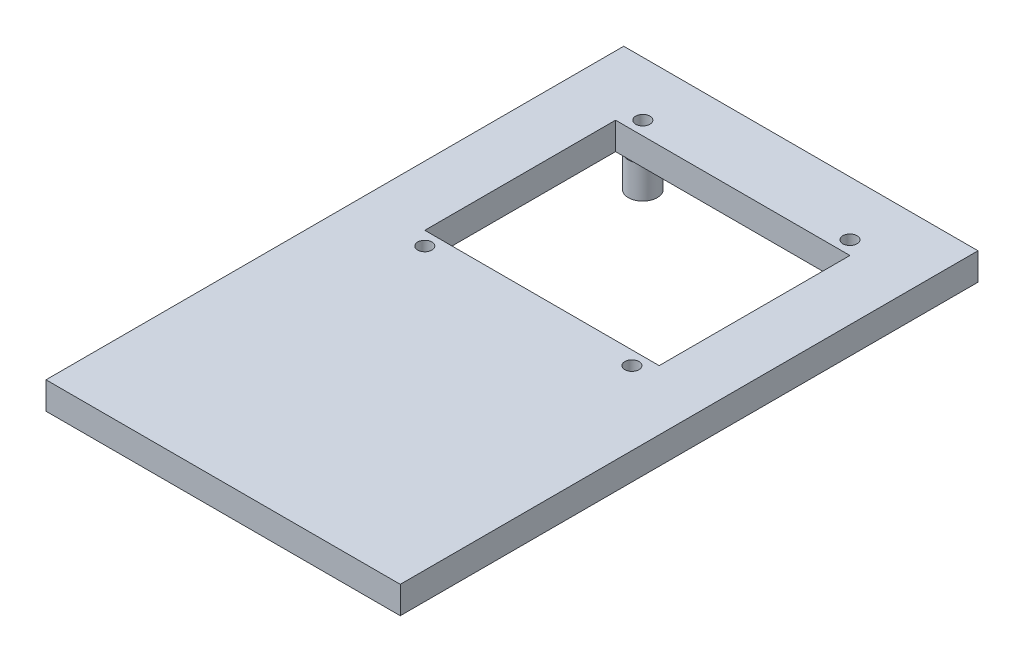
from build123d import *

# Parameters (mm, degrees)
SKETCH3_W           = 65
SKETCH3_H           = 60
BOSS_EXTRUDE3_DEPTH = 5
SKETCH5_W           = 43
SKETCH5_H           = 35
CUT_EXTRUDE2_DEPTH  = 10
CUT_EXTRUDE1_REACH  = 57.982
SKETCH4_R           = 1.3
SKETCH9_R           = 2.65
SKETCH9_R_2         = 1.05
BOSS_EXTRUDE5_DEPTH = 6
SKETCH11_W          = 65
SKETCH11_H          = 5
BOSS_EXTRUDE7_DEPTH = 46


with BuildPart() as part:
    # Sketch3 → Boss-Extrude3 (new body)
    with BuildSketch(Plane(origin=(0, 0, 0), x_dir=(1, 0, 0), z_dir=(0, 1, 0))):
        with Locations((-14.5, 0)):
            Rectangle(SKETCH3_W, SKETCH3_H)
    extrude(amount=BOSS_EXTRUDE3_DEPTH)

    # Sketch5 → Cut-Extrude2 (cut)
    with BuildSketch(Plane.XZ):
        with Locations((-14.5, 0)):
            Rectangle(SKETCH5_W, SKETCH5_H)
    extrude(amount=-CUT_EXTRUDE2_DEPTH, mode=Mode.SUBTRACT)

    # Sketch4 → Cut-Extrude1 (cut, up to next)
    with BuildSketch(Plane(origin=(0, 5, 0), x_dir=(1, 0, 0), z_dir=(0, 1, 0)), mode=Mode.PRIVATE) as cut_extrude1_sk1:
        with Locations(Location((-33.5, 20, 0), (0, 0, 270))):
            Circle(SKETCH4_R)
    cut_extrude1_tool1 = extrude(cut_extrude1_sk1.sketch, amount=-CUT_EXTRUDE1_REACH, mode=Mode.PRIVATE) & part.part
    # Sketch4 → Cut-Extrude1 (cut, up to next)
    with BuildSketch(Plane(origin=(0, 5, 0), x_dir=(1, 0, 0), z_dir=(0, 1, 0)), mode=Mode.PRIVATE) as cut_extrude1_sk2:
        with Locations(Location((4.5, 20, 0), (0, 0, 270))):
            Circle(SKETCH4_R)
    cut_extrude1_tool2 = extrude(cut_extrude1_sk2.sketch, amount=-CUT_EXTRUDE1_REACH, mode=Mode.PRIVATE) & part.part
    # Sketch4 → Cut-Extrude1 (cut, up to next)
    with BuildSketch(Plane(origin=(0, 5, 0), x_dir=(1, 0, 0), z_dir=(0, 1, 0)), mode=Mode.PRIVATE) as cut_extrude1_sk3:
        with Locations(Location((4.5, -20, 0), (0, 0, 270))):
            Circle(SKETCH4_R)
    cut_extrude1_tool3 = extrude(cut_extrude1_sk3.sketch, amount=-CUT_EXTRUDE1_REACH, mode=Mode.PRIVATE) & part.part
    # Sketch4 → Cut-Extrude1 (cut, up to next)
    with BuildSketch(Plane(origin=(0, 5, 0), x_dir=(1, 0, 0), z_dir=(0, 1, 0)), mode=Mode.PRIVATE) as cut_extrude1_sk4:
        with Locations(Location((-33.5, -20, 0), (0, 0, 270))):
            Circle(SKETCH4_R)
    cut_extrude1_tool4 = extrude(cut_extrude1_sk4.sketch, amount=-CUT_EXTRUDE1_REACH, mode=Mode.PRIVATE) & part.part
    add(cut_extrude1_tool1.solids().sort_by_distance((-33.5, 5, -20))[0], mode=Mode.SUBTRACT)
    add(cut_extrude1_tool2.solids().sort_by_distance((4.5, 5, -20))[0], mode=Mode.SUBTRACT)
    add(cut_extrude1_tool3.solids().sort_by_distance((4.5, 5, 20))[0], mode=Mode.SUBTRACT)
    add(cut_extrude1_tool4.solids().sort_by_distance((-33.5, 5, 20))[0], mode=Mode.SUBTRACT)

    # Sketch9 → Boss-Extrude5 (add)
    # profile 1 of 4: a face of its own
    with BuildSketch(Plane.XZ):
        with Locations(Location((-33.5, 20, 0), (0, 0, 250.629961754))):
            Circle(SKETCH9_R)
        with Locations(Location((-33.5, 20, 0), (0, 0, 270))):
            Circle(SKETCH9_R_2, mode=Mode.SUBTRACT)
    # profile 2 of 4: a face of its own
    with BuildSketch(Plane.XZ):
        with Locations(Location((-33.5, -20, 0), (0, 0, 109.370038246))):
            Circle(SKETCH9_R)
        with Locations(Location((-33.5, -20, 0), (0, 0, 270))):
            Circle(SKETCH9_R_2, mode=Mode.SUBTRACT)
    # profile 3 of 4: a face of its own
    with BuildSketch(Plane.XZ):
        with Locations(Location((4.5, 20, 0), (0, 0, 289.370038246))):
            Circle(SKETCH9_R)
        with Locations(Location((4.5, 20, 0), (0, 0, 270))):
            Circle(SKETCH9_R_2, mode=Mode.SUBTRACT)
    # profile 4 of 4: a face of its own
    with BuildSketch(Plane.XZ):
        with Locations(Location((4.5, -20, 0), (0, 0, 109.370038246))):
            Circle(SKETCH9_R)
        with Locations(Location((4.5, -20, 0), (0, 0, 270))):
            Circle(SKETCH9_R_2, mode=Mode.SUBTRACT)
    extrude(amount=BOSS_EXTRUDE5_DEPTH)

    # Sketch11 → Boss-Extrude7 (add)
    with BuildSketch(Plane.XY.offset(30)):
        with Locations((-14.5, 2.5)):
            Rectangle(SKETCH11_W, SKETCH11_H)
    extrude(amount=BOSS_EXTRUDE7_DEPTH)


solid = part.part
